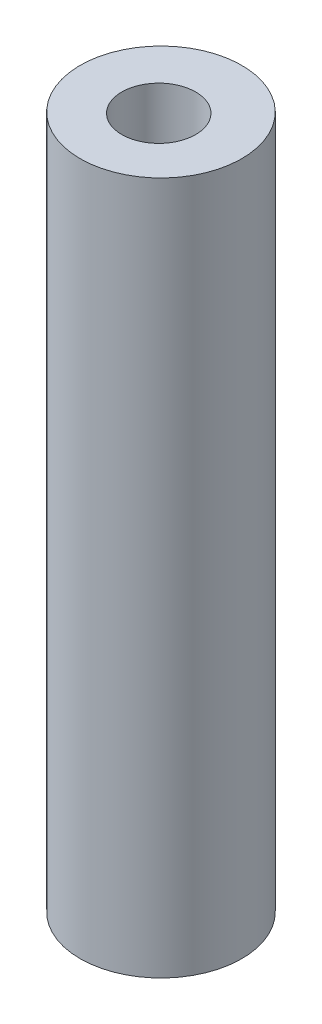
from build123d import *

# Parameters (mm, degrees)
SKETCH1_R           = 3.5
SKETCH1_R_2         = 1.6
BOSS_EXTRUDE1_DEPTH = 30


with BuildPart() as part:
    # Sketch1 → Boss-Extrude1 (new body)
    with BuildSketch(Plane(origin=(0, 0, 0), x_dir=(1, 0, 0), z_dir=(0, 1, 0))):
        Circle(SKETCH1_R)
        with Locations((0, -0.095073122)):
            Circle(SKETCH1_R_2, mode=Mode.SUBTRACT)
    extrude(amount=BOSS_EXTRUDE1_DEPTH)


solid = part.part
